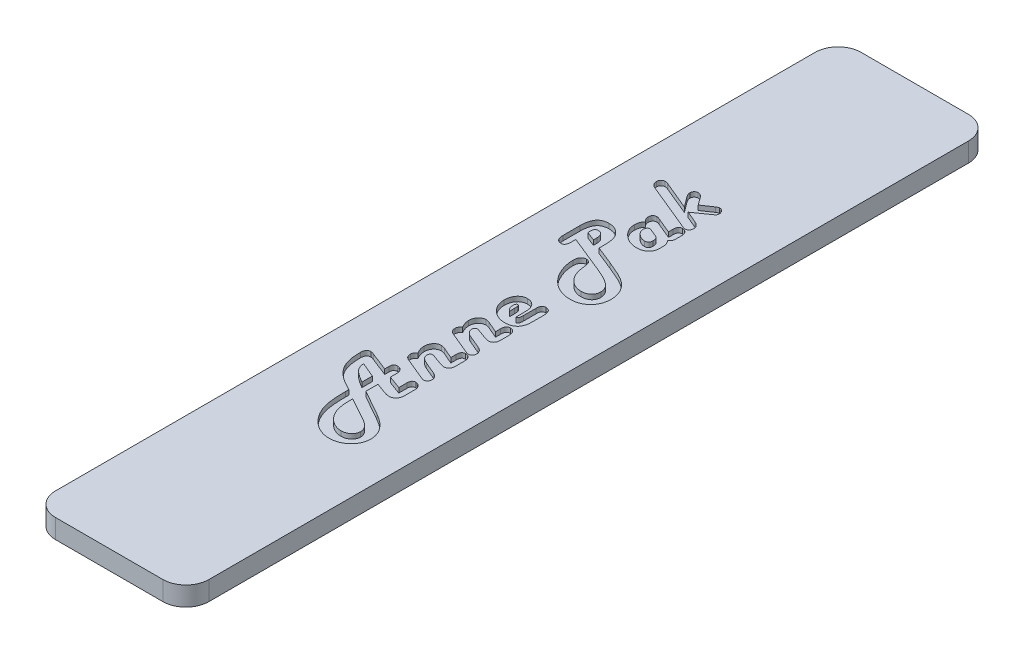
from build123d import *

# Parameters (mm, degrees)
BOSS_EXTRUDE1_DEPTH      = 66.675
BOSS_EXTRUDE1_DEPTH_BACK = 66.675
SKETCH3_W                = 25.4
SKETCH3_H                = 3.175
SKETCH5_OUTSIDE_W        = 54.556
SKETCH5_OUTSIDE_H        = 162.506
CUT_EXTRUDE2_DEPTH       = 68.947967225
CUT_EXTRUDE1_DEPTH       = 0.79375


with BuildPart() as part:
    # Sketch3 → Boss-Extrude1 (new, two sides: drawn at the far end of the back side and taken through both)
    with BuildSketch(Plane.XY.offset(-BOSS_EXTRUDE1_DEPTH_BACK)):
        Rectangle(SKETCH3_W, SKETCH3_H)
    extrude(amount=BOSS_EXTRUDE1_DEPTH + BOSS_EXTRUDE1_DEPTH_BACK)

    # Sketch5 outside → Cut-Extrude2 (cut, through all)
    with BuildSketch(Plane(origin=(0, 1.5875, 0), x_dir=(1, 0, 0), z_dir=(0, 1, 0))):
        Rectangle(SKETCH5_OUTSIDE_W, SKETCH5_OUTSIDE_H)
        with BuildLine():
            Line((12.7, -62.865), (12.7, 62.865))
            ThreePointArc((12.7, 62.865), (11.584076836, 65.559076836), (8.89, 66.675))
            Line((8.89, 66.675), (-8.89, 66.675))
            ThreePointArc((-8.89, 66.675), (-11.584076836, 65.559076836), (-12.7, 62.865))
            Line((-12.7, 62.865), (-12.7, -62.865))
            ThreePointArc((-12.7, -62.865), (-11.584076836, -65.559076836), (-8.89, -66.675))
            Line((-8.89, -66.675), (8.89, -66.675))
            ThreePointArc((8.89, -66.675), (11.584076836, -65.559076836), (12.7, -62.865))
        make_face(mode=Mode.SUBTRACT)
    extrude(amount=-CUT_EXTRUDE2_DEPTH, mode=Mode.SUBTRACT)

    # Sketch4 → Cut-Extrude1 (cut)
    # profile 1 of 7: a face of its own
    with BuildSketch(Plane(origin=(0, 1.5875, 0), x_dir=(1, 0, 0), z_dir=(0, 1, 0))):
        with BuildLine():
            Line((-1.295616438, -20.881849315), (-1.295616438, -22.883133562))
            Line((-1.295616438, -22.883133562), (2.948818493, -25.282534247))
            add(Edge.make_bspline(
                [(2.948818493, -25.282534247), (3.071585592, -25.352625153), (3.31176096, -25.489747471), (3.652010486, -25.712571953), (3.971356746, -25.935308145), (4.265287908, -26.165994777), (4.53827465, -26.398520768), (4.786750676, -26.637637815), (5.009648761, -26.883411356), (5.21301187, -27.130535527), (5.387604309, -27.387131231), (5.543640645, -27.645110339), (5.671808431, -27.910962202), (5.780421409, -28.179826113), (5.86053387, -28.455639506), (5.922188279, -28.734174487), (5.956211822, -29.018852628), (5.961827167, -29.210106792), (5.964657534, -29.306506849)],
                knots=[0, 0, 0, 0, 1.284127512, 2.512202389, 3.693820525, 4.820683154, 5.905595552, 6.95085666, 7.951169987, 8.919030195, 9.855848477, 10.768583501, 11.655730142, 12.534476643, 13.400021201, 14.262063092, 15.124007484, 16, 16, 16, 16], degree=3))
            add(Edge.make_bspline(
                [(5.964657534, -29.306506849), (5.961153186, -29.423671228), (5.954286446, -29.653253785), (5.906432562, -29.991291003), (5.825636301, -30.314278774), (5.710631168, -30.623180605), (5.565628615, -30.917484034), (5.384513119, -31.195629594), (5.175684571, -31.461789347), (4.933501689, -31.707911312), (4.670257339, -31.934172916), (4.387379054, -32.13219109), (4.087619823, -32.29616262), (3.775443027, -32.436763452), (3.444807893, -32.538864639), (3.101012618, -32.617706517), (2.740975712, -32.662867642), (2.495886972, -32.668407769), (2.370907534, -32.671232877)],
                knots=[0, 0, 0, 0, 1.023509052, 2.005556865, 2.976162568, 3.926806602, 4.88020563, 5.83639235, 6.821600422, 7.8310613, 8.847943164, 9.850897116, 10.841415261, 11.829399931, 12.83678008, 13.859073563, 14.908265711, 16, 16, 16, 16], degree=3))
            add(Edge.make_bspline(
                [(2.370907534, -32.671232877), (2.268043807, -32.669575663), (2.062373347, -32.666262154), (1.755746022, -32.626883194), (1.451338298, -32.57059253), (1.149767167, -32.487592517), (0.850918077, -32.383918897), (0.555660023, -32.253157224), (0.262670881, -32.101944759), (-0.02488, -31.926466204), (-0.304733769, -31.731672901), (-0.575520857, -31.520213297), (-0.831396054, -31.288357587), (-1.076541232, -31.041200281), (-1.310118878, -30.777999931), (-1.530648623, -30.496915945), (-1.739079532, -30.198745063), (-1.866752789, -29.989988295), (-1.931318493, -29.884417808)],
                knots=[0, 0, 0, 0, 0.920360802, 1.840211654, 2.763493683, 3.690106123, 4.637553702, 5.592892168, 6.578521632, 7.587450506, 8.606298991, 9.629842057, 10.661069622, 11.695398393, 12.745173504, 13.809615302, 14.892299487, 16, 16, 16, 16], degree=3))
            add(Edge.make_bspline(
                [(-1.931318493, -29.884417808), (-2.019890413, -29.720338123), (-2.198010996, -29.390369338), (-2.4129951, -28.865226383), (-2.585860962, -28.314857847), (-2.69854726, -27.835876043), (-2.769533144, -27.431043003), (-2.81256929, -27.100119038), (-2.855453955, -26.745855019), (-2.882339586, -26.366432441), (-2.910023765, -25.963480578), (-2.925547909, -25.535908968), (-2.936765563, -25.084249457), (-2.938541589, -24.775264918), (-2.939452055, -24.616866438)],
                knots=[0, 0, 0, 0, 1.235982978, 2.485595966, 3.756177378, 5.05891948, 5.745857238, 6.481327979, 7.271967052, 8.112145328, 9.003570026, 9.950725021, 10.949455392, 12, 12, 12, 12], degree=3))
            Line((-2.939452055, -24.616866438), (-2.939452055, -24.081763699))
            Line((-2.939452055, -24.081763699), (-3.975410959, -23.514554795))
            add(Edge.make_bspline(
                [(-3.975410959, -23.514554795), (-4.149557271, -23.415659842), (-4.489478673, -23.222623823), (-4.962329897, -22.89950471), (-5.394232337, -22.564346351), (-5.776467053, -22.207773486), (-6.119604297, -21.839817612), (-6.409691637, -21.449393879), (-6.663386529, -21.047062075), (-6.793798793, -20.762162943), (-6.858544521, -20.620719178)],
                knots=[0, 0, 0, 0, 1.154231185, 2.252978409, 3.298924017, 4.303170672, 5.263936639, 6.195269199, 7.104005978, 8, 8, 8, 8], degree=3))
            add(Edge.make_bspline(
                [(-6.858544521, -20.620719178), (-6.896286328, -20.526316636), (-6.97367056, -20.332757589), (-7.066466212, -20.025385205), (-7.144820551, -19.697094866), (-7.212019091, -19.348832636), (-7.25982697, -18.978402472), (-7.295510012, -18.58786075), (-7.320757521, -18.175983156), (-7.322249397, -17.894588809), (-7.323013699, -17.750428082)],
                knots=[0, 0, 0, 0, 0.833580457, 1.709138717, 2.630308376, 3.601286859, 4.616795241, 5.692327562, 6.817759698, 8, 8, 8, 8], degree=3))
            add(Edge.make_bspline(
                [(-7.323013699, -17.750428082), (-7.320583847, -17.678930268), (-7.315956282, -17.54276526), (-7.280506959, -17.350225653), (-7.2182065, -17.181651241), (-7.130333681, -17.037973832), (-7.018150883, -16.923387982), (-6.885831949, -16.837762469), (-6.73099726, -16.790799765), (-6.621971851, -16.78423422), (-6.565308219, -16.780821918)],
                knots=[0, 0, 0, 0, 1.235229773, 2.35245055, 3.366973227, 4.325000809, 5.240507286, 6.116206508, 7.020938506, 8, 8, 8, 8], degree=3))
            add(Edge.make_bspline(
                [(-6.565308219, -16.780821918), (-6.505621834, -16.78570643), (-6.373653528, -16.796506226), (-6.248553992, -16.840307197), (-6.180034247, -16.864297945)],
                knots=[0, 0, 0, 0, 0.904556353, 2, 2, 2, 2], degree=3))
            Line((-6.180034247, -16.864297945), (-6.017363014, -16.928510274))
            Line((-6.017363014, -16.928510274), (-2.939452055, -18.129280822))
            Line((-2.939452055, -18.129280822), (-2.939452055, -17.581335616))
            Line((-2.939452055, -17.581335616), (-2.939452055, -17.392979452))
            add(Edge.make_bspline(
                [(-2.939452055, -17.392979452), (-2.937730068, -17.334294536), (-2.934487007, -17.223771743), (-2.902051927, -17.069807289), (-2.85102607, -16.93758691), (-2.778046201, -16.827454948), (-2.679938322, -16.743072867), (-2.560892959, -16.685999084), (-2.423104009, -16.647621201), (-2.324019721, -16.645144695), (-2.271643836, -16.643835616)],
                knots=[0, 0, 0, 0, 1.224457869, 2.306052593, 3.269225765, 4.170438305, 5.03696607, 5.936821825, 6.909405468, 8, 8, 8, 8], degree=3))
            add(Edge.make_bspline(
                [(-2.271643836, -16.643835616), (-2.206201902, -16.647153318), (-2.077393564, -16.653683499), (-1.893383819, -16.717513641), (-1.725077022, -16.818092375), (-1.5774348, -16.955986345), (-1.45034212, -17.11857559), (-1.360360336, -17.305536073), (-1.303921877, -17.509571175), (-1.298440224, -17.65158633), (-1.295616438, -17.724743151)],
                knots=[0, 0, 0, 0, 0.967844388, 1.904993043, 2.854314898, 3.858179587, 4.884883616, 5.897857367, 6.917115065, 8, 8, 8, 8], degree=3))
            Line((-1.295616438, -17.724743151), (-1.295616438, -17.919520548))
            Line((-1.295616438, -17.919520548), (-1.295616438, -18.831335616))
            Line((-1.295616438, -18.831335616), (0.896164384, -19.631849315))
            Line((0.896164384, -19.631849315), (0.896164384, -18.454623288))
            Line((0.896164384, -18.454623288), (0.896164384, -18.266267123))
            add(Edge.make_bspline(
                [(0.896164384, -18.266267123), (0.898160062, -18.203368003), (0.901905457, -18.085321881), (0.93066785, -17.920197275), (0.982102962, -17.779709967), (1.054453212, -17.663304353), (1.151477261, -17.574464675), (1.266973882, -17.508067938), (1.40576485, -17.472933152), (1.503865126, -17.468226493), (1.555410959, -17.465753425)],
                knots=[0, 0, 0, 0, 1.273098158, 2.389290989, 3.376549181, 4.286045457, 5.134299476, 6.013945099, 6.956446832, 8, 8, 8, 8], degree=3))
            add(Edge.make_bspline(
                [(1.555410959, -17.465753425), (1.622314811, -17.469739781), (1.753457997, -17.477553732), (1.940584354, -17.543689381), (2.111823341, -17.648238977), (2.258238512, -17.795718212), (2.385557234, -17.966473879), (2.475742205, -18.162589912), (2.531413056, -18.375927554), (2.537090583, -18.524193286), (2.54, -18.600171233)],
                knots=[0, 0, 0, 0, 0.959970407, 1.881708946, 2.821665646, 3.823251842, 4.851715016, 5.871022397, 6.909017313, 8, 8, 8, 8], degree=3))
            Line((2.54, -18.600171233), (2.54, -18.79494863))
            Line((2.54, -18.79494863), (2.54, -20.340325342))
            add(Edge.make_bspline(
                [(2.54, -20.340325342), (2.536040471, -20.436987842), (2.528413047, -20.623193282), (2.465743389, -20.889149689), (2.359420533, -21.126562691), (2.214022903, -21.333164403), (2.034029431, -21.501351082), (1.825458311, -21.624533735), (1.591204765, -21.700484701), (1.4261358, -21.70831022), (1.341369863, -21.712328767)],
                knots=[0, 0, 0, 0, 1.135640793, 2.187637353, 3.190204587, 4.177136149, 5.13878535, 6.063917208, 7.005786023, 8, 8, 8, 8], degree=3))
            add(Edge.make_bspline(
                [(1.341369863, -21.712328767), (1.265522359, -21.708461321), (1.097319661, -21.699884707), (0.826048408, -21.64113138), (0.512166361, -21.549815928), (0.291424916, -21.470377684), (0.172705479, -21.42765411)],
                knots=[0, 0, 0, 0, 0.753316793, 1.670587834, 2.747192678, 4, 4, 4, 4], degree=3))
            Line((0.172705479, -21.42765411), (-1.295616438, -20.881849315))
        make_face()
        with BuildLine():
            Line((-2.939452055, -20.173373288), (-5.430890411, -19.133133562))
            add(Edge.make_bspline(
                [(-5.430890411, -19.133133562), (-5.419124767, -19.256516623), (-5.396212154, -19.496794883), (-5.297034552, -19.838024782), (-5.154382626, -20.149488854), (-4.99561144, -20.386463648), (-4.836746792, -20.562191519), (-4.698638149, -20.701435653), (-4.535935634, -20.842147554), (-4.354515003, -20.989984601), (-4.150744676, -21.141728476), (-3.924993114, -21.297393092), (-3.68010881, -21.460796604), (-3.506370066, -21.566021161), (-3.416763699, -21.620291096)],
                knots=[0, 0, 0, 0, 1.327479438, 2.585155888, 3.790872231, 4.992669277, 5.627155637, 6.330882107, 7.09570796, 7.933840435, 8.841788147, 9.820799051, 10.876069462, 12, 12, 12, 12], degree=3))
            Line((-3.416763699, -21.620291096), (-2.939452055, -21.915667808))
            Line((-2.939452055, -21.915667808), (-2.939452055, -20.173373288))
        make_face(mode=Mode.SUBTRACT)
        with BuildLine():
            Line((-1.295616438, -25.072773973), (-1.295616438, -25.684931507))
            add(Edge.make_bspline(
                [(-1.295616438, -25.684931507), (-1.293085762, -25.851237144), (-1.28814845, -26.175696893), (-1.251661846, -26.649590414), (-1.190828705, -27.097358801), (-1.102430369, -27.518314614), (-0.992724043, -27.91334076), (-0.854882318, -28.281190363), (-0.693538033, -28.623718619), (-0.563425086, -28.834573501), (-0.499383562, -28.938356164)],
                knots=[0, 0, 0, 0, 1.17507216, 2.292547767, 3.356328211, 4.36586142, 5.329840842, 6.250349605, 7.138822986, 8, 8, 8, 8], degree=3))
            add(Edge.make_bspline(
                [(-0.499383562, -28.938356164), (-0.412374077, -29.061945834), (-0.239832842, -29.307026175), (0.06803343, -29.631793037), (0.403408288, -29.921657834), (0.766946255, -30.167789366), (1.147534891, -30.367968968), (1.537259268, -30.50905009), (1.928589302, -30.600762252), (2.191339838, -30.611240559), (2.321678082, -30.616438356)],
                knots=[0, 0, 0, 0, 1.061931571, 2.105827722, 3.137883091, 4.174868311, 5.187188109, 6.15404082, 7.084306037, 8, 8, 8, 8], degree=3))
            add(Edge.make_bspline(
                [(2.321678082, -30.616438356), (2.436312103, -30.611140918), (2.660754229, -30.600769055), (2.984392523, -30.517817128), (3.280567651, -30.378002977), (3.502067293, -30.218727832), (3.65905773, -30.070120937), (3.763682595, -29.952087081), (3.849271509, -29.825912065), (3.922728807, -29.696365538), (3.979369306, -29.559917672), (4.017306634, -29.417305485), (4.04158813, -29.269516335), (4.045085323, -29.168901186), (4.046849315, -29.118150685)],
                knots=[0, 0, 0, 0, 1.625345399, 3.182266278, 4.704124598, 6.249545861, 7.030225429, 7.76935358, 8.482720177, 9.189807842, 9.879872433, 10.572531956, 11.279981989, 12, 12, 12, 12], degree=3))
            add(Edge.make_bspline(
                [(4.046849315, -29.118150685), (4.042352195, -29.028502865), (4.033360239, -28.849252784), (3.958832924, -28.586073671), (3.838160835, -28.333064411), (3.673618852, -28.086105576), (3.458299218, -27.851344007), (3.198205244, -27.623094251), (2.891614513, -27.403085568), (2.664639513, -27.271183244), (2.546421233, -27.202482877)],
                knots=[0, 0, 0, 0, 0.841394824, 1.682362055, 2.549233927, 3.467926034, 4.460234473, 5.5338279, 6.715512172, 8, 8, 8, 8], degree=3))
            Line((2.546421233, -27.202482877), (-1.295616438, -25.072773973))
        make_face(mode=Mode.SUBTRACT)
    # profile 2 of 7: a face of its own
    with BuildSketch(Plane(origin=(0, 1.5875, 0), x_dir=(1, 0, 0), z_dir=(0, 1, 0))):
        with BuildLine():
            Line((0.896164384, -11.023116438), (0.896164384, -10.15625))
            add(Edge.make_bspline(
                [(0.896164384, -10.15625), (0.89781328, -10.084733169), (0.900899841, -9.950861229), (0.933687033, -9.764618201), (0.982737833, -9.604427952), (1.058321423, -9.473547077), (1.155277043, -9.370254462), (1.274611526, -9.298607129), (1.414660115, -9.254028287), (1.515093193, -9.249154883), (1.568253425, -9.246575342)],
                knots=[0, 0, 0, 0, 1.332558988, 2.494409445, 3.51712345, 4.441593639, 5.28878003, 6.131038744, 7.010740127, 8, 8, 8, 8], degree=3))
            add(Edge.make_bspline(
                [(1.568253425, -9.246575342), (1.640824352, -9.249578269), (1.781068511, -9.255381459), (1.977524163, -9.319785138), (2.148699236, -9.423453242), (2.291177317, -9.568166117), (2.404826055, -9.746950516), (2.483737539, -9.959144414), (2.53358201, -10.199591247), (2.537796978, -10.370736507), (2.54, -10.460188356)],
                knots=[0, 0, 0, 0, 0.988786751, 1.910841876, 2.790517751, 3.700688286, 4.660983863, 5.664234098, 6.779174028, 8, 8, 8, 8], degree=3))
            Line((2.54, -10.460188356), (2.54, -11.969178082))
            add(Edge.make_bspline(
                [(2.54, -11.969178082), (2.536478652, -12.035760993), (2.529645045, -12.16497326), (2.483082761, -12.351914222), (2.395862666, -12.518519891), (2.28445036, -12.668490534), (2.144965342, -12.790992769), (1.985959711, -12.879954007), (1.809645762, -12.937079874), (1.685713471, -12.942439752), (1.621763699, -12.945205479)],
                knots=[0, 0, 0, 0, 1.068903624, 2.074337967, 3.062738177, 4.06817252, 5.058163504, 6.016931881, 6.976725497, 8, 8, 8, 8], degree=3))
            add(Edge.make_bspline(
                [(1.621763699, -12.945205479), (1.57665129, -12.942852168), (1.475400248, -12.937570357), (1.310906128, -12.898220971), (1.115096192, -12.84626914), (0.977145639, -12.796559195), (0.902585616, -12.769691781)],
                knots=[0, 0, 0, 0, 0.728058364, 1.634066332, 2.72125148, 4, 4, 4, 4], degree=3))
            Line((0.902585616, -12.769691781), (-0.634229452, -12.217465753))
            add(Edge.make_bspline(
                [(-0.634229452, -12.217465753), (-0.706248192, -12.191356742), (-0.832765119, -12.14549046), (-0.966274153, -12.129972261), (-1.023784247, -12.123287671)],
                knots=[0, 0, 0, 0, 1.138483872, 2, 2, 2, 2], degree=3))
            add(Edge.make_bspline(
                [(-1.023784247, -12.123287671), (-1.051061356, -12.124168505), (-1.104592019, -12.12589712), (-1.183205806, -12.150692297), (-1.254403419, -12.196721211), (-1.315458699, -12.261740273), (-1.366878245, -12.339111657), (-1.406626642, -12.427667905), (-1.426985538, -12.528363912), (-1.430679173, -12.598381978), (-1.43260274, -12.63484589)],
                knots=[0, 0, 0, 0, 0.891859407, 1.750252314, 2.665438183, 3.64169252, 4.654009479, 5.701670483, 6.803079096, 8, 8, 8, 8], degree=3))
            add(Edge.make_bspline(
                [(-1.43260274, -12.63484589), (-1.429127971, -12.694383311), (-1.422184436, -12.81335531), (-1.371397668, -12.986918349), (-1.285574118, -13.150629044), (-1.165035177, -13.303089607), (-1.013721099, -13.448153631), (-0.826149979, -13.57907357), (-0.609895291, -13.707399843), (-0.448918909, -13.777478317), (-0.364537671, -13.814212329)],
                knots=[0, 0, 0, 0, 0.844704782, 1.68795045, 2.544298561, 3.454102781, 4.435689125, 5.509683468, 6.694616022, 8, 8, 8, 8], degree=3))
            Line((-0.364537671, -13.814212329), (1.630325342, -14.653253425))
            add(Edge.make_bspline(
                [(1.630325342, -14.653253425), (1.702468375, -14.685209753), (1.840228206, -14.746231564), (2.025929392, -14.85885919), (2.184898239, -14.980827711), (2.314822181, -15.116067948), (2.415859819, -15.264328509), (2.486742105, -15.424639594), (2.531391245, -15.596216852), (2.537098299, -15.714625122), (2.54, -15.774828767)],
                knots=[0, 0, 0, 0, 1.228540311, 2.345943872, 3.375718969, 4.343035516, 5.255843253, 6.156722805, 7.062801887, 8, 8, 8, 8], degree=3))
            add(Edge.make_bspline(
                [(2.54, -15.774828767), (2.538280929, -15.824279711), (2.534946679, -15.92019305), (2.499217925, -16.058145683), (2.440598463, -16.184473884), (2.360382084, -16.29594772), (2.26439364, -16.389180352), (2.155051507, -16.457040465), (2.034454031, -16.500519543), (1.949613827, -16.504714492), (1.906438356, -16.506849315)],
                knots=[0, 0, 0, 0, 1.10043993, 2.134375199, 3.15203089, 4.189386559, 5.179442654, 6.11523781, 7.040838075, 8, 8, 8, 8], degree=3))
            add(Edge.make_bspline(
                [(1.906438356, -16.506849315), (1.872048364, -16.505827269), (1.79895239, -16.503654909), (1.686592034, -16.476288375), (1.562359382, -16.443961602), (1.479419777, -16.409497366), (1.435547945, -16.391267123)],
                knots=[0, 0, 0, 0, 0.84408435, 1.794102367, 2.833165756, 4, 4, 4, 4], degree=3))
            Line((1.435547945, -16.391267123), (1.24505137, -16.312071918))
            Line((1.24505137, -16.312071918), (-2.256660959, -14.858732877))
            add(Edge.make_bspline(
                [(-2.256660959, -14.858732877), (-2.310771337, -14.834254521), (-2.414867081, -14.787163876), (-2.555882992, -14.699620608), (-2.673417652, -14.596912798), (-2.771322719, -14.482968058), (-2.847325226, -14.354737974), (-2.900593554, -14.214232761), (-2.933907618, -14.061905278), (-2.937566147, -13.956370508), (-2.939452055, -13.901969178)],
                knots=[0, 0, 0, 0, 1.133500777, 2.180591034, 3.155994585, 4.103301528, 5.037982408, 5.986855797, 6.962259347, 8, 8, 8, 8], degree=3))
            add(Edge.make_bspline(
                [(-2.939452055, -13.901969178), (-2.938703108, -13.857593827), (-2.937241878, -13.771015441), (-2.911915888, -13.646982957), (-2.876732614, -13.530724401), (-2.822072432, -13.426258066), (-2.755542529, -13.330150119), (-2.671971504, -13.245434223), (-2.573819744, -13.170602675), (-2.499833984, -13.130465722), (-2.462140411, -13.110017123)],
                knots=[0, 0, 0, 0, 1.084507589, 2.115925057, 3.08838965, 4.049487383, 4.989875946, 5.941237156, 6.951120778, 8, 8, 8, 8], degree=3))
            add(Edge.make_bspline(
                [(-2.462140411, -13.110017123), (-2.535687141, -12.984082159), (-2.677028871, -12.742060987), (-2.823355812, -12.363508528), (-2.921293771, -11.996252752), (-2.933500775, -11.752143919), (-2.939452055, -11.633133562)],
                knots=[0, 0, 0, 0, 1.112280528, 2.137575052, 3.092012134, 4, 4, 4, 4], degree=3))
            add(Edge.make_bspline(
                [(-2.939452055, -11.633133562), (-2.935104671, -11.524307749), (-2.926716164, -11.314322569), (-2.857382899, -11.013927203), (-2.740618989, -10.74384238), (-2.579574057, -10.508402889), (-2.385323705, -10.311301163), (-2.156314467, -10.171811611), (-1.903424047, -10.082916358), (-1.725161852, -10.073380392), (-1.63380137, -10.068493151)],
                knots=[0, 0, 0, 0, 1.146863251, 2.212933495, 3.230738006, 4.232643822, 5.206458578, 6.125429401, 7.03927093, 8, 8, 8, 8], degree=3))
            add(Edge.make_bspline(
                [(-1.63380137, -10.068493151), (-1.580157719, -10.070812376), (-1.46925611, -10.075607086), (-1.299546165, -10.107932771), (-1.121190419, -10.156003142), (-1.003348466, -10.204144751), (-0.94244863, -10.229023973)],
                knots=[0, 0, 0, 0, 0.901170678, 1.863058847, 2.895644873, 4, 4, 4, 4], degree=3))
            Line((-0.94244863, -10.229023973), (0.896164384, -11.023116438))
        make_face()
    # profile 3 of 7: a face of its own
    with BuildSketch(Plane(origin=(0, 1.5875, 0), x_dir=(1, 0, 0), z_dir=(0, 1, 0))):
        with BuildLine():
            Line((0.896164384, -3.625856164), (0.896164384, -2.758989726))
            add(Edge.make_bspline(
                [(0.896164384, -2.758989726), (0.89781328, -2.687472895), (0.900899841, -2.553600955), (0.933687033, -2.367357928), (0.982737833, -2.207167678), (1.058321423, -2.076286803), (1.155277043, -1.972994188), (1.274611526, -1.901346855), (1.414660115, -1.856768013), (1.515093193, -1.851894609), (1.568253425, -1.849315068)],
                knots=[0, 0, 0, 0, 1.332558988, 2.494409445, 3.51712345, 4.441593639, 5.28878003, 6.131038744, 7.010740127, 8, 8, 8, 8], degree=3))
            add(Edge.make_bspline(
                [(1.568253425, -1.849315068), (1.640824352, -1.852317995), (1.781068511, -1.858121185), (1.977524163, -1.922524864), (2.148699236, -2.026192968), (2.291177317, -2.170905843), (2.404826055, -2.349690243), (2.483737539, -2.56188414), (2.53358201, -2.802330973), (2.537796978, -2.973476233), (2.54, -3.062928082)],
                knots=[0, 0, 0, 0, 0.988786751, 1.910841876, 2.790517751, 3.700688286, 4.660983863, 5.664234098, 6.779174028, 8, 8, 8, 8], degree=3))
            Line((2.54, -3.062928082), (2.54, -4.571917808))
            add(Edge.make_bspline(
                [(2.54, -4.571917808), (2.536478652, -4.638500719), (2.529645045, -4.767712986), (2.483082761, -4.954653948), (2.395862666, -5.121259617), (2.28445036, -5.27123026), (2.144965342, -5.393732495), (1.985959711, -5.482693733), (1.809645762, -5.5398196), (1.685713471, -5.545179478), (1.621763699, -5.547945205)],
                knots=[0, 0, 0, 0, 1.068903624, 2.074337967, 3.062738177, 4.06817252, 5.058163504, 6.016931881, 6.976725497, 8, 8, 8, 8], degree=3))
            add(Edge.make_bspline(
                [(1.621763699, -5.547945205), (1.57665129, -5.545591894), (1.475400248, -5.540310083), (1.310906128, -5.500960697), (1.115096192, -5.449008866), (0.977145639, -5.399298921), (0.902585616, -5.372431507)],
                knots=[0, 0, 0, 0, 0.728058364, 1.634066332, 2.72125148, 4, 4, 4, 4], degree=3))
            Line((0.902585616, -5.372431507), (-0.634229452, -4.820205479))
            add(Edge.make_bspline(
                [(-0.634229452, -4.820205479), (-0.706248192, -4.794096468), (-0.832765119, -4.748230186), (-0.966274153, -4.732711987), (-1.023784247, -4.726027397)],
                knots=[0, 0, 0, 0, 1.138483872, 2, 2, 2, 2], degree=3))
            add(Edge.make_bspline(
                [(-1.023784247, -4.726027397), (-1.051061356, -4.726908231), (-1.104592019, -4.728636846), (-1.183205806, -4.753432023), (-1.254403419, -4.799460937), (-1.315458699, -4.864479999), (-1.366878245, -4.941851383), (-1.406626642, -5.030407631), (-1.426985538, -5.131103638), (-1.430679173, -5.201121704), (-1.43260274, -5.237585616)],
                knots=[0, 0, 0, 0, 0.891859407, 1.750252314, 2.665438183, 3.64169252, 4.654009479, 5.701670483, 6.803079096, 8, 8, 8, 8], degree=3))
            add(Edge.make_bspline(
                [(-1.43260274, -5.237585616), (-1.429127971, -5.297123037), (-1.422184436, -5.416095037), (-1.371397668, -5.589658076), (-1.285574118, -5.75336877), (-1.165035177, -5.905829333), (-1.013721099, -6.050893357), (-0.826149979, -6.181813296), (-0.609895291, -6.310139569), (-0.448918909, -6.380218043), (-0.364537671, -6.416952055)],
                knots=[0, 0, 0, 0, 0.844704782, 1.68795045, 2.544298561, 3.454102781, 4.435689125, 5.509683468, 6.694616022, 8, 8, 8, 8], degree=3))
            Line((-0.364537671, -6.416952055), (1.630325342, -7.255993151))
            add(Edge.make_bspline(
                [(1.630325342, -7.255993151), (1.702468375, -7.287949479), (1.840228206, -7.34897129), (2.025929392, -7.461598916), (2.184898239, -7.583567437), (2.314822181, -7.718807674), (2.415859819, -7.867068235), (2.486742105, -8.02737932), (2.531391245, -8.198956578), (2.537098299, -8.317364848), (2.54, -8.377568493)],
                knots=[0, 0, 0, 0, 1.228540311, 2.345943872, 3.375718969, 4.343035516, 5.255843253, 6.156722805, 7.062801887, 8, 8, 8, 8], degree=3))
            add(Edge.make_bspline(
                [(2.54, -8.377568493), (2.538280929, -8.427019437), (2.534946679, -8.522932776), (2.499217925, -8.660885409), (2.440598463, -8.78721361), (2.360382084, -8.898687446), (2.26439364, -8.991920078), (2.155051507, -9.059780191), (2.034454031, -9.103259269), (1.949613827, -9.107454218), (1.906438356, -9.109589041)],
                knots=[0, 0, 0, 0, 1.10043993, 2.134375199, 3.15203089, 4.189386559, 5.179442654, 6.11523781, 7.040838075, 8, 8, 8, 8], degree=3))
            add(Edge.make_bspline(
                [(1.906438356, -9.109589041), (1.872048364, -9.108566995), (1.79895239, -9.106394635), (1.686592034, -9.079028101), (1.562359382, -9.046701328), (1.479419777, -9.012237092), (1.435547945, -8.994006849)],
                knots=[0, 0, 0, 0, 0.84408435, 1.794102367, 2.833165756, 4, 4, 4, 4], degree=3))
            Line((1.435547945, -8.994006849), (1.24505137, -8.914811644))
            Line((1.24505137, -8.914811644), (-2.256660959, -7.461472603))
            add(Edge.make_bspline(
                [(-2.256660959, -7.461472603), (-2.310771337, -7.436994247), (-2.414867081, -7.389903602), (-2.555882992, -7.302360334), (-2.673417652, -7.199652524), (-2.771322719, -7.085707784), (-2.847325226, -6.9574777), (-2.900593554, -6.816972487), (-2.933907618, -6.664645004), (-2.937566147, -6.559110234), (-2.939452055, -6.504708904)],
                knots=[0, 0, 0, 0, 1.133500777, 2.180591034, 3.155994585, 4.103301528, 5.037982408, 5.986855797, 6.962259347, 8, 8, 8, 8], degree=3))
            add(Edge.make_bspline(
                [(-2.939452055, -6.504708904), (-2.938703108, -6.460333553), (-2.937241878, -6.373755167), (-2.911915888, -6.249722683), (-2.876732614, -6.133464127), (-2.822072432, -6.028997793), (-2.755542529, -5.932889845), (-2.671971504, -5.848173949), (-2.573819744, -5.773342401), (-2.499833984, -5.733205448), (-2.462140411, -5.712756849)],
                knots=[0, 0, 0, 0, 1.084507589, 2.115925057, 3.08838965, 4.049487383, 4.989875946, 5.941237156, 6.951120778, 8, 8, 8, 8], degree=3))
            add(Edge.make_bspline(
                [(-2.462140411, -5.712756849), (-2.535687141, -5.586821885), (-2.677028871, -5.344800713), (-2.823355812, -4.966248254), (-2.921293771, -4.598992478), (-2.933500775, -4.354883645), (-2.939452055, -4.235873288)],
                knots=[0, 0, 0, 0, 1.112280528, 2.137575052, 3.092012134, 4, 4, 4, 4], degree=3))
            add(Edge.make_bspline(
                [(-2.939452055, -4.235873288), (-2.935104671, -4.127047475), (-2.926716164, -3.917062295), (-2.857382899, -3.616666929), (-2.740618989, -3.346582106), (-2.579574057, -3.111142615), (-2.385323705, -2.914040889), (-2.156314467, -2.774551337), (-1.903424047, -2.685656084), (-1.725161852, -2.676120118), (-1.63380137, -2.671232877)],
                knots=[0, 0, 0, 0, 1.146863251, 2.212933495, 3.230738006, 4.232643822, 5.206458578, 6.125429401, 7.03927093, 8, 8, 8, 8], degree=3))
            add(Edge.make_bspline(
                [(-1.63380137, -2.671232877), (-1.580157719, -2.673552102), (-1.46925611, -2.678346813), (-1.299546165, -2.710672497), (-1.121190419, -2.758742868), (-1.003348466, -2.806884477), (-0.94244863, -2.831763699)],
                knots=[0, 0, 0, 0, 0.901170678, 1.863058847, 2.895644873, 4, 4, 4, 4], degree=3))
            Line((-0.94244863, -2.831763699), (0.896164384, -3.625856164))
        make_face()
    # profile 4 of 7: a face of its own
    with BuildSketch(Plane(origin=(0, 1.5875, 0), x_dir=(1, 0, 0), z_dir=(0, 1, 0))):
        with BuildLine():
            add(Edge.make_bspline(
                [(0.485205479, 0.151969178), (0.517756621, 0.154203382), (0.581105968, 0.158551474), (0.66882459, 0.200087546), (0.741661321, 0.267604445), (0.798876586, 0.360499044), (0.843990289, 0.477200445), (0.874049625, 0.618733983), (0.893306161, 0.785716099), (0.89516532, 0.905329205), (0.896164384, 0.969606164)],
                knots=[0, 0, 0, 0, 0.764367135, 1.48757176, 2.238468815, 3.079136104, 4.038989023, 5.178564659, 6.483834326, 8, 8, 8, 8], degree=3))
            Line((0.896164384, 0.969606164), (0.896164384, 3.114297945))
            add(Edge.make_bspline(
                [(0.896164384, 3.114297945), (0.897845932, 3.186526131), (0.901011907, 3.322515406), (0.933836463, 3.512229004), (0.982265841, 3.6761604), (1.058305916, 3.809713042), (1.155156215, 3.914987556), (1.273984409, 3.989424422), (1.414737085, 4.033504634), (1.515119833, 4.038468478), (1.568253425, 4.04109589)],
                knots=[0, 0, 0, 0, 1.330378268, 2.504800222, 3.540784378, 4.466013521, 5.313015675, 6.152526175, 7.022113639, 8, 8, 8, 8], degree=3))
            add(Edge.make_bspline(
                [(1.568253425, 4.04109589), (1.64083197, 4.038100811), (1.781090853, 4.032312786), (1.97744335, 3.967802859), (2.149429434, 3.864255544), (2.291101807, 3.717077454), (2.405391827, 3.535880228), (2.483928318, 3.319150043), (2.533665817, 3.072334981), (2.537821652, 2.89624091), (2.54, 2.803938356)],
                knots=[0, 0, 0, 0, 0.976459769, 1.88701984, 2.755728993, 3.661387505, 4.617841531, 5.626579212, 6.755933135, 8, 8, 8, 8], degree=3))
            Line((2.54, 2.803938356), (2.54, 0.75984589))
            add(Edge.make_bspline(
                [(2.54, 0.75984589), (2.538498971, 0.667026582), (2.53559464, 0.487431168), (2.509171856, 0.226354055), (2.467638756, -0.017257747), (2.406991582, -0.244179178), (2.331071401, -0.455142592), (2.234367496, -0.647686079), (2.121707372, -0.823409643), (1.993935794, -0.982879549), (1.846468801, -1.122033884), (1.68632924, -1.24557382), (1.50762556, -1.346478841), (1.313832731, -1.430123456), (1.104412336, -1.496076291), (0.879361474, -1.543171004), (0.63861038, -1.571286921), (0.472441412, -1.573962596), (0.386746575, -1.575342466)],
                knots=[0, 0, 0, 0, 1.227434829, 2.374954843, 3.467242871, 4.492791281, 5.478078509, 6.427692534, 7.336082474, 8.235159391, 9.122921699, 10.011937165, 10.903903105, 11.829580614, 12.799608803, 13.802811811, 14.866890212, 16, 16, 16, 16], degree=3))
            add(Edge.make_bspline(
                [(0.386746575, -1.575342466), (0.27529072, -1.572561706), (0.055729393, -1.567083776), (-0.267626242, -1.520683898), (-0.578471097, -1.445644266), (-0.879544621, -1.342607308), (-1.167326721, -1.207390338), (-1.444743769, -1.043474067), (-1.707437797, -0.846889005), (-1.958138807, -0.626600152), (-2.187995288, -0.385426942), (-2.386869774, -0.127435269), (-2.558330015, 0.139606152), (-2.698722771, 0.418986683), (-2.805102894, 0.711066725), (-2.882747934, 1.013480524), (-2.931632929, 1.32688738), (-2.936825326, 1.540203903), (-2.939452055, 1.648116438)],
                knots=[0, 0, 0, 0, 1.040413245, 2.049551489, 3.043375534, 4.023141954, 5.015714557, 6.007526584, 7.026927923, 8.074887039, 9.121150428, 10.132661257, 11.112246432, 12.080619832, 13.046032014, 14.009142413, 14.992865218, 16, 16, 16, 16], degree=3))
            add(Edge.make_bspline(
                [(-2.939452055, 1.648116438), (-2.937442252, 1.725914984), (-2.93350729, 1.878235532), (-2.913500509, 2.101114935), (-2.87365921, 2.311039329), (-2.823588014, 2.510134015), (-2.754315656, 2.696852124), (-2.67077078, 2.872045181), (-2.574876712, 3.037057751), (-2.460203657, 3.186213752), (-2.335762022, 3.322684271), (-2.199287464, 3.441775916), (-2.053853946, 3.542961739), (-1.898107029, 3.624285184), (-1.734296616, 3.690077035), (-1.55926394, 3.733821343), (-1.375083247, 3.763047479), (-1.248645155, 3.76574886), (-1.184315068, 3.767123288)],
                knots=[0, 0, 0, 0, 1.20765167, 2.364442186, 3.467641136, 4.520347312, 5.546697016, 6.552049339, 7.529957554, 8.502082256, 9.465848252, 10.391794486, 11.307021153, 12.208414204, 13.113065312, 14.039540961, 15.002543477, 16, 16, 16, 16], degree=3))
            add(Edge.make_bspline(
                [(-1.184315068, 3.767123288), (-1.107819997, 3.764731991), (-0.958096616, 3.760051521), (-0.741213008, 3.721357456), (-0.540220667, 3.656084091), (-0.353170282, 3.569227748), (-0.184652246, 3.450302942), (-0.030384031, 3.308963713), (0.10960169, 3.141718726), (0.185136878, 3.014874583), (0.224075342, 2.949486301)],
                knots=[0, 0, 0, 0, 1.069075517, 2.092495602, 3.067309766, 4.01772645, 4.964103366, 5.938458037, 6.93727308, 8, 8, 8, 8], degree=3))
            add(Edge.make_bspline(
                [(0.224075342, 2.949486301), (0.245815438, 2.910016951), (0.290796308, 2.828353753), (0.33971322, 2.691878526), (0.385182547, 2.54345117), (0.424024217, 2.381424879), (0.451113845, 2.20454269), (0.469332866, 2.014411531), (0.483154329, 1.810271458), (0.484506156, 1.669546207), (0.485205479, 1.596746575)],
                knots=[0, 0, 0, 0, 0.775695059, 1.604934926, 2.492087677, 3.452766344, 4.473981776, 5.574285297, 6.74513539, 8, 8, 8, 8], degree=3))
            Line((0.485205479, 1.596746575), (0.485205479, 0.151969178))
        make_face()
        with BuildLine():
            Line((-0.884657534, 0.498715753), (-0.884657534, 1.29494863))
            add(Edge.make_bspline(
                [(-0.884657534, 1.29494863), (-0.885670373, 1.361297974), (-0.887555968, 1.484820168), (-0.896204511, 1.657415629), (-0.917855063, 1.801721272), (-0.943812843, 1.920343877), (-0.980392519, 2.011044767), (-1.020588456, 2.080613514), (-1.079199118, 2.119893873), (-1.121074096, 2.122174733), (-1.141506849, 2.123287671)],
                knots=[0, 0, 0, 0, 1.703756022, 3.171872855, 4.430737384, 5.448043455, 6.277929624, 6.938312386, 7.48195314, 8, 8, 8, 8], degree=3))
            add(Edge.make_bspline(
                [(-1.141506849, 2.123287671), (-1.164680225, 2.120300435), (-1.209182799, 2.114563691), (-1.270664555, 2.084288727), (-1.321852732, 2.038929487), (-1.363341756, 1.978431101), (-1.395800383, 1.904521806), (-1.415025871, 1.815055933), (-1.431455001, 1.712204211), (-1.43220441, 1.638214452), (-1.43260274, 1.598886986)],
                knots=[0, 0, 0, 0, 0.839283018, 1.611774451, 2.433858042, 3.284934843, 4.2429058, 5.330802008, 6.5812524, 8, 8, 8, 8], degree=3))
            add(Edge.make_bspline(
                [(-1.43260274, 1.598886986), (-1.431043071, 1.542416207), (-1.427985788, 1.431721499), (-1.40145814, 1.270180682), (-1.359424558, 1.117487476), (-1.297730616, 0.974327645), (-1.222213662, 0.839183958), (-1.124704301, 0.716120792), (-1.014611987, 0.599202728), (-0.92844664, 0.532575577), (-0.884657534, 0.498715753)],
                knots=[0, 0, 0, 0, 1.059074119, 2.076009944, 3.063613489, 4.023510937, 4.995010178, 5.959100355, 6.962817714, 8, 8, 8, 8], degree=3))
        make_face(mode=Mode.SUBTRACT)
    # profile 5 of 7: a face of its own
    with BuildSketch(Plane(origin=(0, 1.5875, 0), x_dir=(1, 0, 0), z_dir=(0, 1, 0))):
        with BuildLine():
            Line((-2.528493151, 16.943493151), (0.468082192, 15.740582192))
            add(Edge.make_bspline(
                [(0.468082192, 15.740582192), (0.646605168, 15.668185648), (0.98930413, 15.529210704), (1.479984957, 15.323217761), (1.927524873, 15.130958641), (2.332073965, 14.951122693), (2.694678773, 14.785166258), (3.012300763, 14.628950577), (3.287632894, 14.488029623), (3.595464196, 14.318411434), (3.938220221, 14.097352849), (4.31394281, 13.803382131), (4.659889364, 13.477363653), (4.863180158, 13.235526096), (4.965085616, 13.114297945)],
                knots=[0, 0, 0, 0, 1.316025526, 2.52628873, 3.635396764, 4.643473973, 5.550686247, 6.359394249, 7.061322966, 7.663498093, 8.7599393, 9.843181906, 10.918831827, 12, 12, 12, 12], degree=3))
            add(Edge.make_bspline(
                [(4.965085616, 13.114297945), (5.033663279, 13.022592297), (5.169396928, 12.84108214), (5.345521293, 12.551751352), (5.496028705, 12.253114611), (5.616316993, 11.941597581), (5.710422447, 11.620035248), (5.779130711, 11.287322341), (5.820954267, 10.943569627), (5.825414086, 10.710733782), (5.827671233, 10.592893836)],
                knots=[0, 0, 0, 0, 1.011044617, 2.001129376, 2.987597007, 3.961339675, 4.946518016, 5.943976879, 6.959431467, 8, 8, 8, 8], degree=3))
            add(Edge.make_bspline(
                [(5.827671233, 10.592893836), (5.825021245, 10.469301294), (5.81984069, 10.227685831), (5.772659738, 9.874836241), (5.702056665, 9.53854536), (5.595312945, 9.220992565), (5.463552066, 8.919458231), (5.29897733, 8.637216252), (5.105962918, 8.372621604), (4.883147102, 8.129769252), (4.638452641, 7.909643427), (4.37311079, 7.718400842), (4.091430482, 7.553854481), (3.790314781, 7.421413726), (3.471895655, 7.318062415), (3.136118995, 7.246592846), (2.783187232, 7.199664748), (2.541583246, 7.194448875), (2.417996575, 7.191780822)],
                knots=[0, 0, 0, 0, 1.095039877, 2.140732475, 3.150521304, 4.13652018, 5.104897175, 6.062745876, 7.026672252, 8.00261995, 8.979018386, 9.939223627, 10.897072327, 11.865449322, 12.849478696, 13.859267525, 14.904960123, 16, 16, 16, 16], degree=3))
            add(Edge.make_bspline(
                [(2.417996575, 7.191780822), (2.251518318, 7.196346933), (1.922840707, 7.205361794), (1.438042785, 7.275868686), (0.969361737, 7.390685438), (0.517140375, 7.556134754), (0.079028027, 7.762600863), (-0.340430111, 8.020924346), (-0.745102437, 8.322848019), (-0.995150141, 8.55496562), (-1.122243151, 8.672945205)],
                knots=[0, 0, 0, 0, 1.013796752, 2.00153641, 2.977647105, 3.948285219, 4.930040032, 5.922901228, 6.94426252, 8, 8, 8, 8], degree=3))
            add(Edge.make_bspline(
                [(-1.122243151, 8.672945205), (-1.189454403, 8.740637885), (-1.325116403, 8.877271615), (-1.513764646, 9.097944313), (-1.694783307, 9.329357574), (-1.863649938, 9.57453101), (-2.023861106, 9.830775009), (-2.175096482, 10.099464736), (-2.312491032, 10.382150748), (-2.486429726, 10.769551761), (-2.666076845, 11.264230744), (-2.823942239, 11.862842164), (-2.919593957, 12.460538264), (-2.932855769, 12.858543307), (-2.939452055, 13.056506849)],
                knots=[0, 0, 0, 0, 0.706169296, 1.425361597, 2.148231665, 2.881015689, 3.628657503, 4.385575625, 5.162942875, 5.955265483, 7.529696308, 9.053365446, 10.534374814, 12, 12, 12, 12], degree=3))
            add(Edge.make_bspline(
                [(-2.939452055, 13.056506849), (-2.937379434, 13.146714227), (-2.933412841, 13.31935354), (-2.881469747, 13.563059678), (-2.806969238, 13.782229429), (-2.694392997, 13.968686959), (-2.558393536, 14.12354346), (-2.396459417, 14.236112758), (-2.212473912, 14.303700837), (-2.083136755, 14.311219851), (-2.016934932, 14.315068493)],
                knots=[0, 0, 0, 0, 1.238099196, 2.369480208, 3.412225081, 4.406632522, 5.344448297, 6.226188743, 7.092066479, 8, 8, 8, 8], degree=3))
            add(Edge.make_bspline(
                [(-2.016934932, 14.315068493), (-1.947119022, 14.31067669), (-1.811008177, 14.302114572), (-1.617625719, 14.230289525), (-1.447947552, 14.108803085), (-1.360234313, 13.999272388), (-1.314880137, 13.942636986)],
                knots=[0, 0, 0, 0, 1.010937669, 1.970891475, 2.950802117, 4, 4, 4, 4], degree=3))
            add(Edge.make_bspline(
                [(-1.314880137, 13.942636986), (-1.288929746, 13.899183091), (-1.230484324, 13.801316311), (-1.175166874, 13.615600563), (-1.128726034, 13.384300735), (-1.110675194, 13.212302819), (-1.100839041, 13.118578767)],
                knots=[0, 0, 0, 0, 0.704559972, 1.586808607, 2.68501851, 4, 4, 4, 4], degree=3))
            add(Edge.make_bspline(
                [(-1.100839041, 13.118578767), (-1.089183296, 13.002843466), (-1.06645289, 12.77714271), (-1.013198311, 12.448314887), (-0.953396538, 12.135398317), (-0.875308109, 11.840115079), (-0.787244725, 11.560930763), (-0.690826584, 11.297131483), (-0.576231042, 11.052013312), (-0.490288613, 10.897783268), (-0.448013699, 10.821917808)],
                knots=[0, 0, 0, 0, 1.159710426, 2.261604866, 3.320677166, 4.335395728, 5.305245955, 6.239579045, 7.134052342, 8, 8, 8, 8], degree=3))
            add(Edge.make_bspline(
                [(-0.448013699, 10.821917808), (-0.372472899, 10.704183884), (-0.223661455, 10.472254179), (0.04912054, 10.163962129), (0.352116735, 9.891876561), (0.686799447, 9.661909936), (1.043062954, 9.478226691), (1.412253838, 9.343463428), (1.792189257, 9.260872173), (2.049445293, 9.251345822), (2.178270548, 9.246575342)],
                knots=[0, 0, 0, 0, 1.047576128, 2.063670475, 3.075290511, 4.094745252, 5.099666308, 6.072755065, 7.034899922, 8, 8, 8, 8], degree=3))
            add(Edge.make_bspline(
                [(2.178270548, 9.246575342), (2.242537202, 9.247743702), (2.368515303, 9.250033969), (2.552365658, 9.26982778), (2.726836326, 9.300654974), (2.889551067, 9.348861552), (3.043074989, 9.406620419), (3.187583666, 9.47654852), (3.319581565, 9.563387487), (3.443202469, 9.658935225), (3.551242103, 9.769062834), (3.649004844, 9.885704154), (3.727875897, 10.014317915), (3.795682208, 10.149766993), (3.846319999, 10.295286161), (3.882408949, 10.449560542), (3.907540976, 10.612050942), (3.909078336, 10.724073183), (3.909863014, 10.78125)],
                knots=[0, 0, 0, 0, 1.180906515, 2.314860832, 3.395146952, 4.432720844, 5.428859457, 6.408284318, 7.375873327, 8.328235049, 9.274073667, 10.205991361, 11.119268818, 12.040047653, 12.985704432, 13.943108951, 14.9501506, 16, 16, 16, 16], degree=3))
            add(Edge.make_bspline(
                [(3.909863014, 10.78125), (3.90827078, 10.854202987), (3.905127769, 10.998209517), (3.866170118, 11.208973944), (3.808908804, 11.412477045), (3.726487079, 11.608389281), (3.621323279, 11.797387062), (3.491837905, 11.978112903), (3.338035606, 12.149871859), (3.160026305, 12.317167374), (2.950112727, 12.47990556), (2.710540998, 12.650678617), (2.43108507, 12.819276683), (2.117671326, 12.996168407), (1.766738772, 13.17387024), (1.380919342, 13.359495103), (0.956785812, 13.543555889), (0.661580923, 13.666886594), (0.50875, 13.730736301)],
                knots=[0, 0, 0, 0, 0.731676688, 1.444303058, 2.145016375, 2.851566032, 3.573211535, 4.312808279, 5.079163071, 5.88508809, 6.762346765, 7.744328667, 8.837972341, 10.037711651, 11.357883797, 12.787164715, 14.33667869, 16, 16, 16, 16], degree=3))
            Line((0.50875, 13.730736301), (-5.679178082, 16.243578767))
            Line((-5.679178082, 16.243578767), (-5.679178082, 15.455907534))
            add(Edge.make_bspline(
                [(-5.679178082, 15.455907534), (-5.6811333, 15.377320854), (-5.684793593, 15.230201593), (-5.713850113, 15.024345042), (-5.763464082, 14.848665259), (-5.836234887, 14.703957396), (-5.930582635, 14.589662078), (-6.047759143, 14.507670813), (-6.187151858, 14.459149456), (-6.286662642, 14.454482422), (-6.338424658, 14.452054795)],
                knots=[0, 0, 0, 0, 1.386647813, 2.595892835, 3.659749566, 4.594681301, 5.434731623, 6.248703716, 7.089037154, 8, 8, 8, 8], degree=3))
            add(Edge.make_bspline(
                [(-6.338424658, 14.452054795), (-6.41249416, 14.455553492), (-6.555373092, 14.462302426), (-6.755997736, 14.53193846), (-6.9307318, 14.644136646), (-7.076066539, 14.801840418), (-7.186412346, 15.001547522), (-7.267857335, 15.235127457), (-7.313402252, 15.504833253), (-7.319689931, 15.695462965), (-7.323013699, 15.796232877)],
                knots=[0, 0, 0, 0, 0.942409434, 1.817893302, 2.674221847, 3.569887169, 4.524363572, 5.567001171, 6.713877944, 8, 8, 8, 8], degree=3))
            Line((-7.323013699, 15.796232877), (-7.323013699, 18.546660959))
            add(Edge.make_bspline(
                [(-7.323013699, 18.546660959), (-7.32135449, 18.660154291), (-7.318136688, 18.880258713), (-7.293905304, 19.198825658), (-7.258037256, 19.495503351), (-7.198353732, 19.767239661), (-7.130043821, 20.017482775), (-7.041032603, 20.243372849), (-6.939566643, 20.448454326), (-6.818400393, 20.630141135), (-6.681374616, 20.789408737), (-6.52658404, 20.926939466), (-6.3539945, 21.042357701), (-6.165637707, 21.139426006), (-5.958895294, 21.21269338), (-5.735292697, 21.262488455), (-5.494671136, 21.295905326), (-5.328270297, 21.299511714), (-5.242534247, 21.301369863)],
                knots=[0, 0, 0, 0, 1.377779469, 2.672010327, 3.877566876, 5.002296731, 6.047021908, 7.023471041, 7.945492411, 8.820022801, 9.667536142, 10.489793169, 11.325896471, 12.182086672, 13.056145004, 13.980726477, 14.959593374, 16, 16, 16, 16], degree=3))
            add(Edge.make_bspline(
                [(-5.242534247, 21.301369863), (-5.136782794, 21.297809144), (-4.929211295, 21.290820078), (-4.624959246, 21.243788385), (-4.336433965, 21.161562809), (-4.061842259, 21.048082841), (-3.8044282, 20.898412197), (-3.56003657, 20.718889265), (-3.329707685, 20.507312527), (-3.194472954, 20.344146337), (-3.125667808, 20.261130137)],
                knots=[0, 0, 0, 0, 1.037190231, 2.03582197, 3.010506387, 3.973515094, 4.942177049, 5.923321209, 6.943420921, 8, 8, 8, 8], degree=3))
            add(Edge.make_bspline(
                [(-3.125667808, 20.261130137), (-3.077697191, 20.195089903), (-2.97920855, 20.059502471), (-2.858370136, 19.830284218), (-2.755424247, 19.576402255), (-2.673160955, 19.296431316), (-2.606848864, 18.992513133), (-2.560454747, 18.662721515), (-2.532528553, 18.307425895), (-2.529867979, 18.06155508), (-2.528493151, 17.934503425)],
                knots=[0, 0, 0, 0, 0.800437442, 1.643380872, 2.535600309, 3.486195869, 4.50417187, 5.586788071, 6.752993229, 8, 8, 8, 8], degree=3))
            Line((-2.528493151, 17.934503425), (-2.528493151, 16.943493151))
        make_face()
        with BuildLine():
            Line((-4.172328767, 17.645547945), (-4.172328767, 18.229880137))
            add(Edge.make_bspline(
                [(-4.172328767, 18.229880137), (-4.174877342, 18.319974043), (-4.179687558, 18.49001856), (-4.22342482, 18.727367093), (-4.298224267, 18.929870106), (-4.403971303, 19.097262793), (-4.543228063, 19.229081679), (-4.715494994, 19.318313868), (-4.91489417, 19.376630306), (-5.058002969, 19.38117049), (-5.133373288, 19.383561644)],
                knots=[0, 0, 0, 0, 1.258971058, 2.376199826, 3.358208907, 4.260347007, 5.121448143, 6.005251248, 6.949436718, 8, 8, 8, 8], degree=3))
            add(Edge.make_bspline(
                [(-5.133373288, 19.383561644), (-5.176329115, 19.38150796), (-5.257705803, 19.377617405), (-5.371940821, 19.348714044), (-5.467070511, 19.294791476), (-5.547836666, 19.222496634), (-5.606457457, 19.125838815), (-5.650070226, 19.011383686), (-5.675062248, 18.87662405), (-5.677746857, 18.780070671), (-5.679178082, 18.72859589)],
                knots=[0, 0, 0, 0, 1.057975811, 2.004258143, 2.869579862, 3.727735231, 4.644179764, 5.623179532, 6.73286349, 8, 8, 8, 8], degree=3))
            Line((-5.679178082, 18.72859589), (-5.679178082, 18.244863014))
            Line((-5.679178082, 18.244863014), (-4.172328767, 17.645547945))
        make_face(mode=Mode.SUBTRACT)
    # profile 6 of 7: a face of its own
    with BuildSketch(Plane(origin=(0, 1.5875, 0), x_dir=(1, 0, 0), z_dir=(0, 1, 0))):
        with BuildLine():
            Line((0.896164384, 24.995719178), (0.896164384, 25.791952055))
            add(Edge.make_bspline(
                [(0.896164384, 25.791952055), (0.898232671, 25.858396907), (0.902126442, 25.983486434), (0.930260522, 26.159544837), (0.98365384, 26.308931679), (1.056535837, 26.432632723), (1.151920799, 26.528960269), (1.269402962, 26.59632385), (1.407801836, 26.63824093), (1.507286626, 26.641905335), (1.559691781, 26.643835616)],
                knots=[0, 0, 0, 0, 1.294659495, 2.437334719, 3.457519937, 4.368220716, 5.213556601, 6.067082152, 6.981805575, 8, 8, 8, 8], degree=3))
            add(Edge.make_bspline(
                [(1.559691781, 26.643835616), (1.632863349, 26.640477274), (1.773179951, 26.634037186), (1.971796539, 26.575254649), (2.142487717, 26.473947446), (2.286523986, 26.33612203), (2.399344309, 26.164264393), (2.485521388, 25.963513692), (2.529847459, 25.731053281), (2.536509118, 25.567367861), (2.54, 25.481592466)],
                knots=[0, 0, 0, 0, 1.020499011, 1.956948009, 2.859423251, 3.7687511, 4.716847855, 5.712717295, 6.801404681, 8, 8, 8, 8], degree=3))
            Line((2.54, 25.481592466), (2.54, 24.556934932))
            add(Edge.make_bspline(
                [(2.54, 24.556934932), (2.538314737, 24.50690879), (2.535092299, 24.411252411), (2.51174929, 24.273377789), (2.470015945, 24.148654613), (2.416281659, 24.032782673), (2.338068205, 23.934691943), (2.250247474, 23.84461136), (2.143617132, 23.768701036), (2.063357867, 23.730927672), (2.022020548, 23.711472603)],
                knots=[0, 0, 0, 0, 1.135251448, 2.170745912, 3.158955961, 4.114801062, 5.050690111, 5.989515837, 6.964505536, 8, 8, 8, 8], degree=3))
            add(Edge.make_bspline(
                [(2.022020548, 23.711472603), (2.100683531, 23.624612325), (2.249151273, 23.460673086), (2.413608612, 23.193121332), (2.520053994, 22.927973138), (2.533497634, 22.749159231), (2.54, 22.662671233)],
                knots=[0, 0, 0, 0, 1.172002926, 2.212026842, 3.135200271, 4, 4, 4, 4], degree=3))
            Line((2.54, 22.662671233), (2.54, 21.840753425))
            add(Edge.make_bspline(
                [(2.54, 21.840753425), (2.538453369, 21.775736854), (2.53543235, 21.648740622), (2.508917171, 21.463030631), (2.466548908, 21.28719354), (2.406529959, 21.120094233), (2.326470582, 20.964503564), (2.231831563, 20.816307522), (2.117675022, 20.680399894), (1.989482048, 20.5531725), (1.845397622, 20.440955182), (1.691959234, 20.339085905), (1.525453307, 20.2559027), (1.34921811, 20.187016997), (1.162759659, 20.134146058), (0.966103598, 20.094520072), (0.758168865, 20.074392128), (0.615805862, 20.070489227), (0.542996575, 20.068493151)],
                knots=[0, 0, 0, 0, 1.038806976, 2.029091485, 2.99167023, 3.926069813, 4.859424868, 5.783114847, 6.730782711, 7.690452028, 8.664715101, 9.645298791, 10.629655371, 11.633506053, 12.665844953, 13.723757455, 14.835852066, 16, 16, 16, 16], degree=3))
            add(Edge.make_bspline(
                [(0.542996575, 20.068493151), (0.431534965, 20.0712684), (0.21125537, 20.076753076), (-0.114774563, 20.123754336), (-0.431731253, 20.197906086), (-0.739947211, 20.303659884), (-1.037895572, 20.439924245), (-1.328987455, 20.601987098), (-1.607700181, 20.799893479), (-1.875995711, 21.020946948), (-2.123027041, 21.261483855), (-2.341587425, 21.512454489), (-2.52481908, 21.773090323), (-2.6751846, 22.041416998), (-2.794995807, 22.316985588), (-2.878651546, 22.60161442), (-2.929142787, 22.89417553), (-2.936004913, 23.091984667), (-2.939452055, 23.19135274)],
                knots=[0, 0, 0, 0, 1.038436407, 2.05224338, 3.063582843, 4.068804017, 5.083657321, 6.113884954, 7.169134107, 8.264944544, 9.351250422, 10.379092992, 11.362431842, 12.315140492, 13.241586482, 14.156891473, 15.074126981, 16, 16, 16, 16], degree=3))
            add(Edge.make_bspline(
                [(-2.939452055, 23.19135274), (-2.937642571, 23.265597955), (-2.934135834, 23.409483463), (-2.911879812, 23.61841101), (-2.868140017, 23.811572797), (-2.811184698, 23.989740469), (-2.738201659, 24.152713555), (-2.647360265, 24.299243526), (-2.540896641, 24.432045963), (-2.455517743, 24.505364016), (-2.412910959, 24.541952055)],
                knots=[0, 0, 0, 0, 1.187941941, 2.302203992, 3.354530118, 4.350764151, 5.29067738, 6.202947275, 7.103213569, 8, 8, 8, 8], degree=3))
            add(Edge.make_bspline(
                [(-2.412910959, 24.541952055), (-2.455025058, 24.572436907), (-2.536835814, 24.631656714), (-2.644294064, 24.733243321), (-2.736136527, 24.84083422), (-2.808789103, 24.957663698), (-2.866905245, 25.080461429), (-2.911081657, 25.209311455), (-2.934128797, 25.346636872), (-2.937649288, 25.44013524), (-2.939452055, 25.488013699)],
                knots=[0, 0, 0, 0, 1.103205467, 2.143084487, 3.132610165, 4.099600995, 5.055365417, 6.013769083, 6.982894815, 8, 8, 8, 8], degree=3))
            add(Edge.make_bspline(
                [(-2.939452055, 25.488013699), (-2.936902028, 25.538879315), (-2.931912876, 25.638398375), (-2.89556012, 25.780381683), (-2.833563971, 25.90908456), (-2.748131007, 26.021416904), (-2.644839448, 26.11565084), (-2.526267528, 26.183167193), (-2.3966412, 26.226784694), (-2.305533689, 26.230811314), (-2.25880137, 26.232876712)],
                knots=[0, 0, 0, 0, 1.08453349, 2.121900051, 3.102199503, 4.112869643, 5.115253576, 6.062989376, 7.006437589, 8, 8, 8, 8], degree=3))
            add(Edge.make_bspline(
                [(-2.25880137, 26.232876712), (-2.224460466, 26.231624053), (-2.15160759, 26.228966584), (-2.03829879, 26.20578586), (-1.915744479, 26.169420469), (-1.833283584, 26.135223269), (-1.79005137, 26.117294521)],
                knots=[0, 0, 0, 0, 0.847236183, 1.797378234, 2.845219729, 4, 4, 4, 4], degree=3))
            Line((-1.79005137, 26.117294521), (-1.599554795, 26.038099315))
            Line((-1.599554795, 26.038099315), (0.896164384, 24.995719178))
        make_face()
        with BuildLine():
            Line((0.896164384, 22.373715753), (0.896164384, 22.555650685))
            add(Edge.make_bspline(
                [(0.896164384, 22.555650685), (0.895161475, 22.601394292), (0.893221852, 22.689862302), (0.871913604, 22.816743674), (0.83533565, 22.9311197), (0.785769772, 23.034165873), (0.721065526, 23.124369308), (0.642828863, 23.203190974), (0.548837672, 23.268296887), (0.478627206, 23.300842715), (0.44239726, 23.317636986)],
                knots=[0, 0, 0, 0, 1.157664044, 2.238919033, 3.244614913, 4.190073881, 5.122668863, 6.042574887, 6.989931157, 8, 8, 8, 8], degree=3))
            Line((0.44239726, 23.317636986), (-0.730547945, 23.805650685))
            add(Edge.make_bspline(
                [(-0.730547945, 23.805650685), (-0.799446823, 23.834828199), (-0.923123516, 23.887203196), (-1.056671844, 23.898920058), (-1.115821918, 23.904109589)],
                knots=[0, 0, 0, 0, 1.114177243, 2, 2, 2, 2], degree=3))
            add(Edge.make_bspline(
                [(-1.115821918, 23.904109589), (-1.145339765, 23.901230815), (-1.204886775, 23.895423398), (-1.292329335, 23.859820872), (-1.368716326, 23.794397273), (-1.438515936, 23.711117692), (-1.498721664, 23.612197505), (-1.537835153, 23.498861673), (-1.565381607, 23.377455981), (-1.568156412, 23.292834063), (-1.569589041, 23.249143836)],
                knots=[0, 0, 0, 0, 0.809745278, 1.63351721, 2.536886947, 3.535238575, 4.604334403, 5.686212968, 6.805393632, 8, 8, 8, 8], degree=3))
            add(Edge.make_bspline(
                [(-1.569589041, 23.249143836), (-1.568089915, 23.204757812), (-1.565062239, 23.115114641), (-1.535376865, 22.982177024), (-1.490380361, 22.850671247), (-1.426656912, 22.720175829), (-1.345321576, 22.590615465), (-1.246317455, 22.461051516), (-1.126955794, 22.335423876), (-0.951863971, 22.170573248), (-0.715865262, 21.992523167), (-0.417538258, 21.832844497), (-0.111979088, 21.731591514), (0.095640643, 21.71870582), (0.198390411, 21.712328767)],
                knots=[0, 0, 0, 0, 0.627706518, 1.267732443, 1.919531944, 2.592823818, 3.31892668, 4.082778462, 4.897707917, 5.769757387, 7.487317347, 9.064628885, 10.547302323, 12, 12, 12, 12], degree=3))
            add(Edge.make_bspline(
                [(0.198390411, 21.712328767), (0.252736908, 21.714400221), (0.355923321, 21.718333241), (0.500696316, 21.746917248), (0.624257795, 21.798796882), (0.726449685, 21.872432789), (0.802231246, 21.970942023), (0.859736401, 22.08678022), (0.890658169, 22.224475682), (0.894263919, 22.322205679), (0.896164384, 22.373715753)],
                knots=[0, 0, 0, 0, 1.183295301, 2.246694931, 3.193249576, 4.081935609, 4.9554176, 5.872573361, 6.878707581, 8, 8, 8, 8], degree=3))
        make_face(mode=Mode.SUBTRACT)
    # profile 7 of 7: a face of its own
    with BuildSketch(Plane(origin=(0, 1.5875, 0), x_dir=(1, 0, 0), z_dir=(0, 1, 0))):
        with BuildLine():
            Line((-0.490821918, 31.318493151), (1.193681507, 32.457191781))
            add(Edge.make_bspline(
                [(1.193681507, 32.457191781), (1.242953412, 32.489780911), (1.334068218, 32.550045524), (1.470577785, 32.61689501), (1.592506271, 32.662368366), (1.671404547, 32.668456736), (1.707380137, 32.671232877)],
                knots=[0, 0, 0, 0, 1.255887376, 2.322417502, 3.235065423, 4, 4, 4, 4], degree=3))
            add(Edge.make_bspline(
                [(1.707380137, 32.671232877), (1.759955766, 32.668180668), (1.865072892, 32.662078232), (2.016215656, 32.604267239), (2.157912262, 32.513830048), (2.286627404, 32.393000442), (2.400426893, 32.253655868), (2.478853712, 32.096676684), (2.533087172, 31.932779766), (2.537677813, 31.81907571), (2.54, 31.761558219)],
                knots=[0, 0, 0, 0, 0.928071962, 1.85554142, 2.826751461, 3.891094006, 4.970707669, 5.993733327, 6.985124821, 8, 8, 8, 8], degree=3))
            add(Edge.make_bspline(
                [(2.54, 31.761558219), (2.536396155, 31.711715886), (2.529194797, 31.612118792), (2.465977963, 31.469701069), (2.365001273, 31.338899235), (2.274980817, 31.268086242), (2.2275, 31.230736301)],
                knots=[0, 0, 0, 0, 0.930781038, 1.859926679, 2.87122956, 4, 4, 4, 4], degree=3))
            Line((2.2275, 31.230736301), (2.103356164, 31.142979452))
            Line((2.103356164, 31.142979452), (-0.298184932, 29.454195205))
            Line((-0.298184932, 29.454195205), (1.619623288, 28.649400685))
            add(Edge.make_bspline(
                [(1.619623288, 28.649400685), (1.692438063, 28.616670875), (1.831586582, 28.55412444), (2.020437081, 28.439901282), (2.179193924, 28.313073357), (2.313262109, 28.178013611), (2.416090328, 28.028067496), (2.486256132, 27.86567813), (2.531662237, 27.692934902), (2.537178898, 27.573777169), (2.54, 27.512842466)],
                knots=[0, 0, 0, 0, 1.228453023, 2.347564987, 3.387240925, 4.35058155, 5.267716185, 6.167850615, 7.063078179, 8, 8, 8, 8], degree=3))
            add(Edge.make_bspline(
                [(2.54, 27.512842466), (2.537261214, 27.463437711), (2.531913765, 27.366975513), (2.497984629, 27.227531731), (2.436640275, 27.10118364), (2.353146797, 26.991513323), (2.255563802, 26.897564624), (2.142459092, 26.831178046), (2.019478864, 26.787053735), (1.933218461, 26.782923869), (1.889315068, 26.780821918)],
                knots=[0, 0, 0, 0, 1.089487153, 2.127210762, 3.140320823, 4.162790909, 5.153300876, 6.105601883, 7.035820593, 8, 8, 8, 8], degree=3))
            add(Edge.make_bspline(
                [(1.889315068, 26.780821918), (1.85349402, 26.781790245), (1.778262615, 26.783823925), (1.663072862, 26.811400809), (1.537268149, 26.84330004), (1.453720374, 26.878123808), (1.409863014, 26.89640411)],
                knots=[0, 0, 0, 0, 0.864183926, 1.814960012, 2.85299057, 4, 4, 4, 4], degree=3))
            Line((1.409863014, 26.89640411), (1.217226027, 26.977739726))
            Line((1.217226027, 26.977739726), (-6.329863014, 30.094178082))
            Line((-6.329863014, 30.094178082), (-6.5225, 30.173373288))
            add(Edge.make_bspline(
                [(-6.5225, 30.173373288), (-6.586078294, 30.201798693), (-6.70826635, 30.25642811), (-6.872341752, 30.360162966), (-7.011665211, 30.475965336), (-7.124037527, 30.606128437), (-7.213540981, 30.747178417), (-7.279284735, 30.900658067), (-7.315449628, 31.068542399), (-7.320447501, 31.184195673), (-7.323013699, 31.243578767)],
                knots=[0, 0, 0, 0, 1.170343253, 2.249226252, 3.254280777, 4.207245384, 5.129637093, 6.054757893, 7.001199944, 8, 8, 8, 8], degree=3))
            add(Edge.make_bspline(
                [(-7.323013699, 31.243578767), (-7.320706948, 31.293090782), (-7.316185945, 31.390129412), (-7.275889584, 31.52871269), (-7.212518293, 31.657270714), (-7.122988212, 31.769944119), (-7.01780099, 31.866873836), (-6.897995279, 31.936437643), (-6.768025585, 31.979939771), (-6.677663732, 31.984155277), (-6.631660959, 31.98630137)],
                knots=[0, 0, 0, 0, 1.053060787, 2.063894497, 3.049836985, 4.089976291, 5.112746039, 6.080227096, 7.022653103, 8, 8, 8, 8], degree=3))
            add(Edge.make_bspline(
                [(-6.631660959, 31.98630137), (-6.593707866, 31.985353452), (-6.514952386, 31.983386452), (-6.393754081, 31.95602882), (-6.263512071, 31.921522522), (-6.176152364, 31.886670244), (-6.130804795, 31.868578767)],
                knots=[0, 0, 0, 0, 0.878046481, 1.822011481, 2.869427469, 4, 4, 4, 4], degree=3))
            Line((-6.130804795, 31.868578767), (-5.933886986, 31.78510274))
            Line((-5.933886986, 31.78510274), (-1.370530822, 29.895119863))
            Line((-1.370530822, 29.895119863), (-2.567020548, 31.513270548))
            add(Edge.make_bspline(
                [(-2.567020548, 31.513270548), (-2.623321304, 31.59336004), (-2.728140397, 31.742468303), (-2.844789169, 31.96963197), (-2.923128046, 32.178170675), (-2.934278574, 32.314666826), (-2.939452055, 32.377996575)],
                knots=[0, 0, 0, 0, 1.228171146, 2.286572973, 3.205025898, 4, 4, 4, 4], degree=3))
            add(Edge.make_bspline(
                [(-2.939452055, 32.377996575), (-2.937091542, 32.426780667), (-2.932541323, 32.52081881), (-2.894234528, 32.655189517), (-2.83386664, 32.776840278), (-2.750265892, 32.884057393), (-2.647330099, 32.971686024), (-2.531407887, 33.0372188), (-2.402337332, 33.074919827), (-2.313268697, 33.07971854), (-2.267363014, 33.082191781)],
                knots=[0, 0, 0, 0, 1.076655761, 2.075404161, 3.062881058, 4.062998374, 5.058628601, 6.03291826, 6.986172501, 8, 8, 8, 8], degree=3))
            add(Edge.make_bspline(
                [(-2.267363014, 33.082191781), (-2.227320021, 33.080349568), (-2.147971302, 33.076699061), (-2.029795287, 33.053203964), (-1.916410139, 33.008468487), (-1.803969649, 32.951406222), (-1.697072406, 32.874398983), (-1.59044136, 32.784085376), (-1.48879043, 32.67430358), (-1.424899656, 32.593210298), (-1.391934932, 32.551369863)],
                knots=[0, 0, 0, 0, 0.904161073, 1.791674836, 2.703974593, 3.647578222, 4.630492943, 5.669839074, 6.797743255, 8, 8, 8, 8], degree=3))
            Line((-1.391934932, 32.551369863), (-1.272071918, 32.386558219))
            Line((-1.272071918, 32.386558219), (-0.490821918, 31.318493151))
        make_face()
    extrude(amount=-CUT_EXTRUDE1_DEPTH, mode=Mode.SUBTRACT)


solid = part.part
